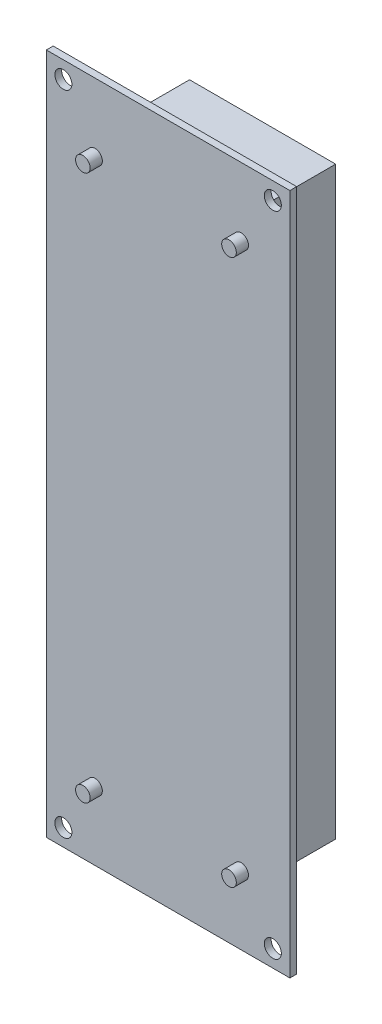
from build123d import *

# Parameters (mm, degrees)
SKETCH1_W           = 50
SKETCH1_H           = 140
BOSS_EXTRUDE1_DEPTH = 0.7
SKETCH3_W           = 30
SKETCH3_H           = 120
BOSS_EXTRUDE2_DEPTH = 18
SKETCH4_R           = 1.75
CUT_EXTRUDE1_DEPTH  = 1.4
SKETCH5_R           = 1.5
BOSS_EXTRUDE3_DEPTH = 2.5


with BuildPart() as part:
    # Sketch1 → Boss-Extrude1 (new, symmetric)
    with BuildSketch(Plane.XY):
        Rectangle(SKETCH1_W, SKETCH1_H)
    extrude(amount=BOSS_EXTRUDE1_DEPTH, both=True)

    # Sketch3 → Boss-Extrude2 (add)
    with BuildSketch(Plane(origin=(0, 0, -0.7), x_dir=(-1, 0, 0), z_dir=(0, 0, -1))):
        Rectangle(SKETCH3_W, SKETCH3_H)
    extrude(amount=BOSS_EXTRUDE2_DEPTH)

    # Sketch4 → Cut-Extrude1 (cut)
    with BuildSketch(Plane(origin=(0, 0, -0.7), x_dir=(-1, 0, 0), z_dir=(0, 0, -1))):
        with Locations((-21.5, 66.5)):
            Circle(SKETCH4_R)
        with Locations((21.5, 66.5)):
            Circle(SKETCH4_R)
        with Locations((-21.5, -66.5)):
            Circle(SKETCH4_R)
        with Locations((21.5, -66.5)):
            Circle(SKETCH4_R)
    extrude(amount=-CUT_EXTRUDE1_DEPTH, mode=Mode.SUBTRACT)

    # Sketch5 → Boss-Extrude3 (add)
    with BuildSketch(Plane.XY.offset(0.7)):
        with Locations(Location((15, 56, 0), (0, 0, 180))):
            Circle(SKETCH5_R)
        with Locations(Location((-15, 56, 0), (0, 0, 180))):
            Circle(SKETCH5_R)
        with Locations(Location((-15, -56, 0), (0, 0, 180))):
            Circle(SKETCH5_R)
        with Locations(Location((15, -56, 0), (0, 0, 180))):
            Circle(SKETCH5_R)
    extrude(amount=BOSS_EXTRUDE3_DEPTH)


solid = part.part
